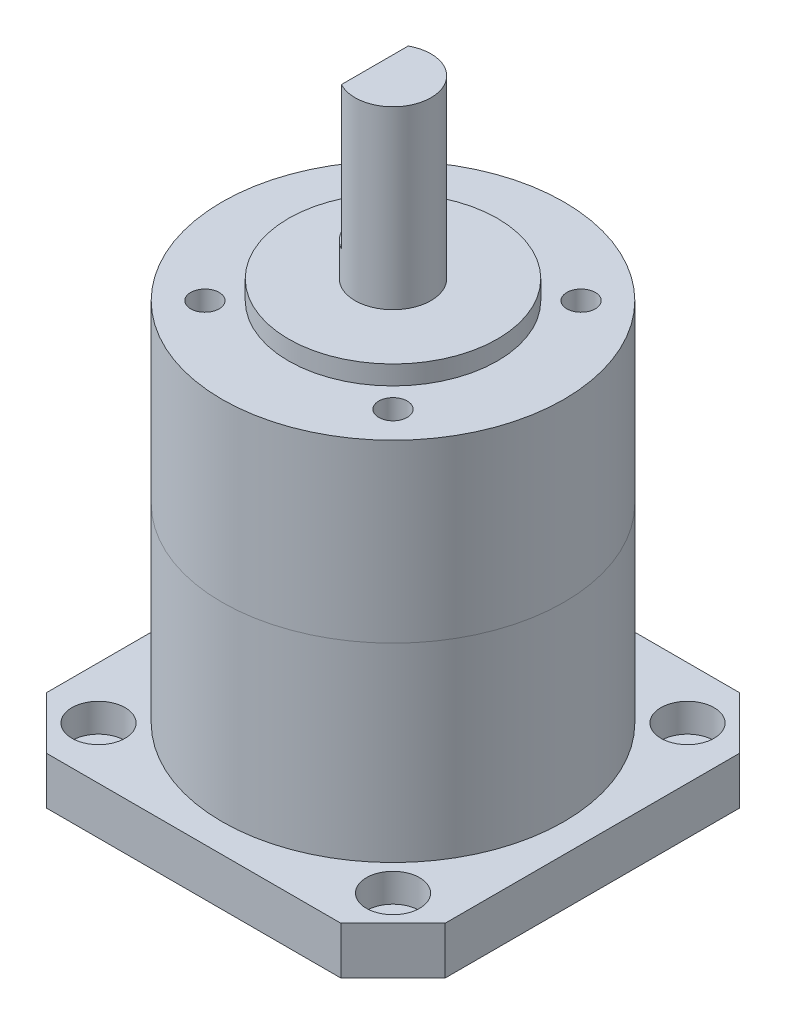
from build123d import *

# Parameters (mm, degrees)
SKETCH_1_W          = 42
SKETCH_1_H          = 42
EXTRUDE_1_DEPTH     = 5
CHAMFER_1_SIZE      = 5.5
SKETCH_2_R          = 1.5
CUT_EXTRUDE_1_DEPTH = 5
SKETCH_3_R          = 18
EXTRUDE_2_DEPTH     = 38.5
SKETCH_4_R          = 1.5
CUT_EXTRUDE_2_DEPTH = 4
SKETCH_6_R          = 11
EXTRUDE_3_DEPTH     = 2
SKETCH_7_R          = 4
EXTRUDE_4_DEPTH     = 18.5
SKETCH_8_R          = 11
CUT_EXTRUDE_3_DEPTH = 3
SKETCH_9_R          = 8
CUT_EXTRUDE_4_DEPTH = 10
CUT_EXTRUDE_START   = -15
CUT_EXTRUDE_5_DEPTH = 15
SKETCH_12_R         = 2.8
CUT_EXTRUDE_6_DEPTH = 3


with BuildPart() as part:
    # 草图1 → 凸台-拉伸1 (new body)
    with BuildSketch(Plane(origin=(0, 0, 0), x_dir=(1, 0, 0), z_dir=(0, 1, 0))):
        Rectangle(SKETCH_1_W, SKETCH_1_H)
    extrude(amount=EXTRUDE_1_DEPTH)

    # 倒角1
    chamfer_1_edges = [part.edges().sort_by_distance(p)[0] for p in [
        (21, 2.5, 21),
        (-21, 2.5, 21),
        (-21, 2.5, -21),
        (21, 2.5, -21),
    ]]
    chamfer(chamfer_1_edges, length=CHAMFER_1_SIZE)

    # 草图2 → 切除-拉伸1 (cut)
    with BuildSketch(Plane.XZ):
        with Locations(Location((-15.5, 15.5, 0), (0, 0, 270))):
            Circle(SKETCH_2_R)
        with Locations(Location((15.5, 15.5, 0), (0, 0, 270))):
            Circle(SKETCH_2_R)
        with Locations(Location((15.5, -15.5, 0), (0, 0, 270))):
            Circle(SKETCH_2_R)
        with Locations(Location((-15.5, -15.5, 0), (0, 0, 270))):
            Circle(SKETCH_2_R)
    extrude(amount=-CUT_EXTRUDE_1_DEPTH, mode=Mode.SUBTRACT)

    # 草图3 → 凸台-拉伸2 (add)
    with BuildSketch(Plane(origin=(0, 5, 0), x_dir=(1, 0, 0), z_dir=(0, 1, 0))):
        with Locations(Location((0, 0, 0), (0, 0, 270))):
            Circle(SKETCH_3_R)
    extrude(amount=EXTRUDE_2_DEPTH)

    # 草图4 → 切除-拉伸2 (cut)
    with BuildSketch(Plane(origin=(0, 43.5, 0), x_dir=(1, 0, 0), z_dir=(0, 1, 0))):
        with Locations(Location((-9.899494937, 9.899494937, 0), (0, 0, 270))):
            Circle(SKETCH_4_R)
        with Locations(Location((9.899494937, 9.899494937, 0), (0, 0, 270))):
            Circle(SKETCH_4_R)
        with Locations(Location((9.899494937, -9.899494937, 0), (0, 0, 270))):
            Circle(SKETCH_4_R)
        with Locations(Location((-9.899494937, -9.899494937, 0), (0, 0, 270))):
            Circle(SKETCH_4_R)
    extrude(amount=-CUT_EXTRUDE_2_DEPTH, mode=Mode.SUBTRACT)

    # 草图6 → 凸台-拉伸3 (add)
    with BuildSketch(Plane(origin=(0, 43.5, 0), x_dir=(1, 0, 0), z_dir=(0, 1, 0))):
        with Locations(Location((0, 0, 0), (0, 0, 270))):
            Circle(SKETCH_6_R)
    extrude(amount=EXTRUDE_3_DEPTH)

    # 草图7 → 凸台-拉伸4 (add)
    with BuildSketch(Plane(origin=(0, 45.5, 0), x_dir=(1, 0, 0), z_dir=(0, 1, 0))):
        with Locations(Location((0, 0, 0), (0, 0, 270))):
            Circle(SKETCH_7_R)
    extrude(amount=EXTRUDE_4_DEPTH)

    # 草图8 → 切除-拉伸3 (cut)
    with BuildSketch(Plane.XZ):
        with Locations(Location((0, 0, 0), (0, 0, 90))):
            Circle(SKETCH_8_R)
    extrude(amount=-CUT_EXTRUDE_3_DEPTH, mode=Mode.SUBTRACT)

    # 草图9 → 切除-拉伸4 (cut)
    with BuildSketch(Plane.XZ.offset(-3)):
        with Locations(Location((0, 0, 0), (0, 0, 270))):
            Circle(SKETCH_9_R)
    extrude(amount=-CUT_EXTRUDE_4_DEPTH, mode=Mode.SUBTRACT)

    # 草图11 → 切除-拉伸5 (cut)
    with BuildSketch(Plane(origin=(0, 64, 0), x_dir=(1, 0, 0), z_dir=(0, 1, 0)).offset(CUT_EXTRUDE_START)):
        with BuildLine():
            Line((-1.914185744, -3.512248986), (-1.914185744, 3.512248986))
            ThreePointArc((-1.914185744, 3.512248986), (-4, 0), (-1.914185744, -3.512248986))
        make_face()
    extrude(amount=CUT_EXTRUDE_5_DEPTH, mode=Mode.SUBTRACT)

    # 草图12 → 切除-拉伸6 (cut)
    with BuildSketch(Plane(origin=(0, 5, 0), x_dir=(1, 0, 0), z_dir=(0, 1, 0))):
        with Locations(Location((-15.5, 15.5, 0), (0, 0, 270))):
            Circle(SKETCH_12_R)
        with Locations(Location((15.5, 15.5, 0), (0, 0, 270))):
            Circle(SKETCH_12_R)
        with Locations(Location((-15.5, -15.5, 0), (0, 0, 270))):
            Circle(SKETCH_12_R)
        with Locations(Location((15.5, -15.5, 0), (0, 0, 270))):
            Circle(SKETCH_12_R)
    extrude(amount=-CUT_EXTRUDE_6_DEPTH, mode=Mode.SUBTRACT)


solid = part.part
